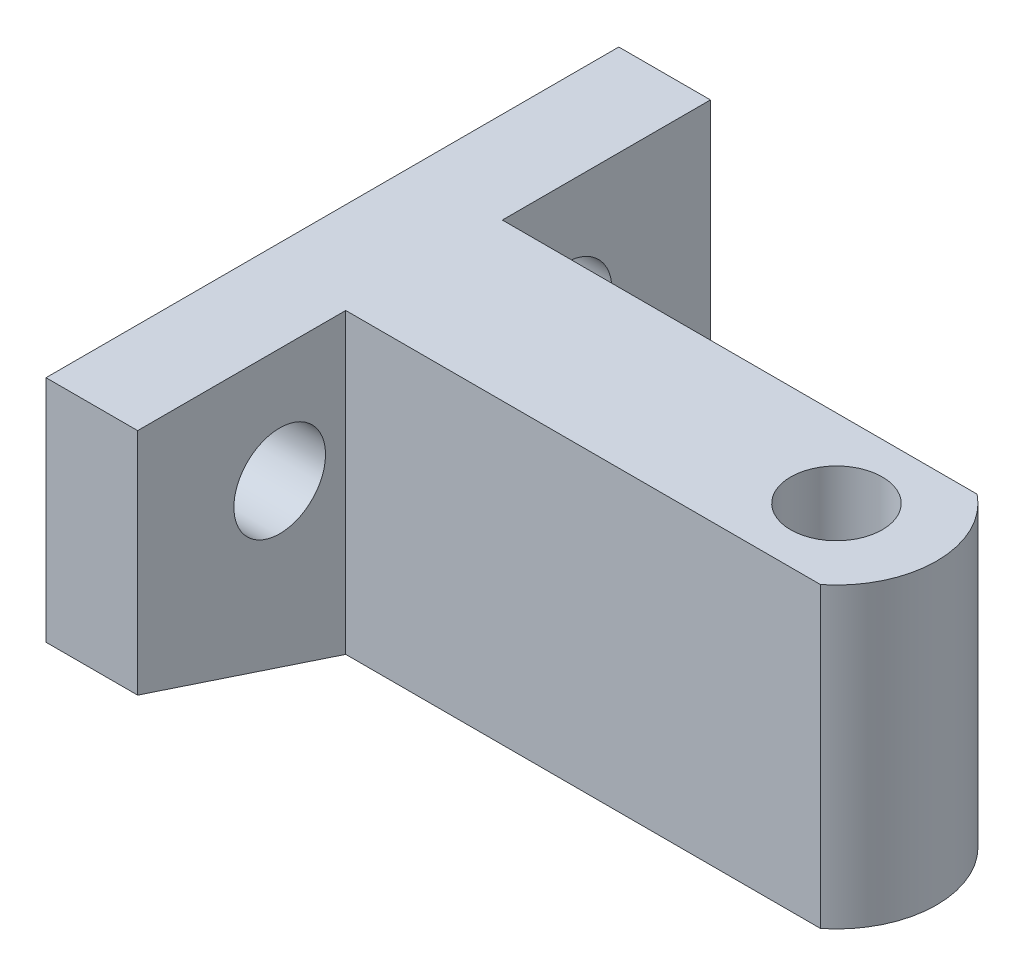
from build123d import *

# Parameters (mm, degrees)
CROQUIS1_W              = 25
CROQUIS1_H              = 10
CROQUIS1_R              = 2
SALIENTE_EXTRUIR1_DEPTH = 4
CROQUIS2_W              = 6.835109388
CROQUIS2_H              = 13
SALIENTE_EXTRUIR2_DEPTH = 24
CROQUIS3_R              = 2
CORTAR_EXTRUIR1_DEPTH   = 24
SALIENTE_EXTRUIR3_DEPTH = 4
CORTAR_EXTRUIR2_DEPTH   = 24


with BuildPart() as part:
    # Croquis1 → Saliente-Extruir1 (new body)
    with BuildSketch(Plane(origin=(0, 0, 0), x_dir=(0, 0, -1), z_dir=(1, 0, 0))):
        with Locations((7.35898106, 5.127314815)):
            Rectangle(CROQUIS1_W, CROQUIS1_H)
        with Locations((1.05898106, 5.127314815)):
            Circle(CROQUIS1_R, mode=Mode.SUBTRACT)
        with Locations((13.55898106, 5.127314815)):
            Circle(CROQUIS1_R, mode=Mode.SUBTRACT)
    extrude(amount=SALIENTE_EXTRUIR1_DEPTH)

    # Croquis2 → Saliente-Extruir2 (add)
    with BuildSketch(Plane(origin=(4, 0, 0), x_dir=(0, 0, -1), z_dir=(1, 0, 0))):
        with Locations((7.35898106, 3.627314815)):
            Rectangle(CROQUIS2_W, CROQUIS2_H)
    extrude(amount=SALIENTE_EXTRUIR2_DEPTH)

    # Croquis3 → Cortar-Extruir1 (cut)
    with BuildSketch(Plane(origin=(0, 10.127314815, 0), x_dir=(1, 0, 0), z_dir=(0, 1, 0))):
        with Locations(Location((22, 7.35898106, 0), (0, 0, 270))):
            Circle(CROQUIS3_R)
    extrude(amount=-CORTAR_EXTRUIR1_DEPTH, mode=Mode.SUBTRACT)

    # Croquis4 → Saliente-Extruir3 (add, through all)
    with BuildSketch(Plane(origin=(4, 0, 0), x_dir=(0, 0, -1), z_dir=(1, 0, 0))):
        Polygon((-5.14101894, 0.127314815), (3.941426366, -2.872685185), (10.776535754, -2.872685185), (19.85898106, 0.127314815), align=None)
    extrude(amount=-SALIENTE_EXTRUIR3_DEPTH)

    # Croquis5 → Cortar-Extruir2 (cut)
    with BuildSketch(Plane(origin=(0, 10.127314815, 0), x_dir=(1, 0, 0), z_dir=(0, 1, 0))):
        with BuildLine():
            Line((28, 3.941426366), (24.720702874, 3.941426366))
            ThreePointArc((24.720702874, 3.941426366), (26.368283898, 7.35898106), (24.720702874, 10.776535754))
            Line((24.720702874, 10.776535754), (28, 10.776535754))
            Line((28, 10.776535754), (28, 3.941426366))
        make_face()
    extrude(amount=-CORTAR_EXTRUIR2_DEPTH, mode=Mode.SUBTRACT)


solid = part.part
